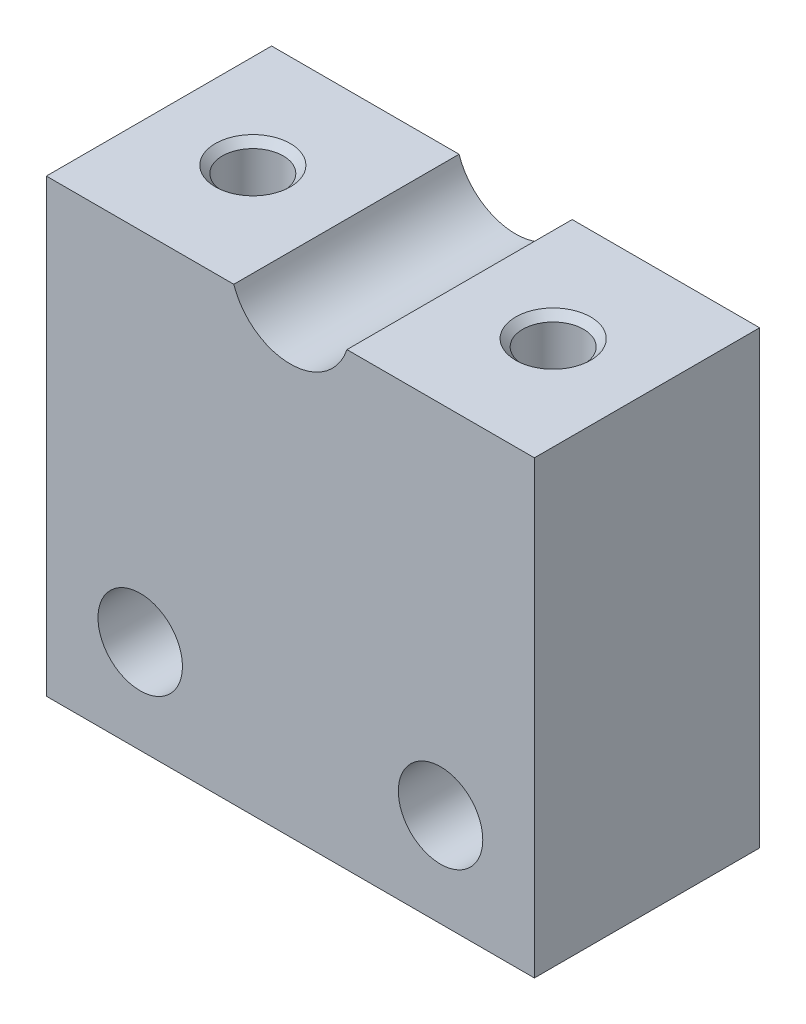
from build123d import *

# Parameters (mm, degrees)
SKETCH1_W                  = 26
SKETCH1_H                  = 24
BOSS_EXTRUDE1_DEPTH        = 12
CUT_EXTRUDE1_DEPTH         = 30.816103032
M3_CLEARANCE_HOLE1_D       = 3.242
M3_CLEARANCE_HOLE1_DEPTH   = 6.064115214
M3_CLEARANCE_HOLE1_TIP     = 0.935884786
F_4_5_4_5_DIAMETER_HOLE1_D = 4.5
CHAMFER1_SIZE              = 0.379


with BuildPart() as part:
    # Sketch1 → Boss-Extrude1 (new body)
    with BuildSketch(Plane.XY.offset(6)):
        with Locations((0, 12)):
            Rectangle(SKETCH1_W, SKETCH1_H)
    extrude(amount=-BOSS_EXTRUDE1_DEPTH)

    # Sketch2 → Cut-Extrude1 (cut, through all)
    with BuildSketch(Plane(origin=(0, 0, -6), x_dir=(-1, 0, 0), z_dir=(0, 0, -1))):
        with BuildLine():
            Line((3.01340754, 24), (-3.01340754, 24))
            ThreePointArc((-3.01340754, 24), (0, 21.825), (3.01340754, 24))
        make_face()
    extrude(amount=-CUT_EXTRUDE1_DEPTH, mode=Mode.SUBTRACT)

    # M3 Clearance Hole1
    with Locations(Plane(origin=(0, 24, 0), x_dir=(1, 0, 0), z_dir=(0, 1, 0))):
        with Locations((8, 0), (-8, 0)):
            Hole(M3_CLEARANCE_HOLE1_D / 2, depth=M3_CLEARANCE_HOLE1_DEPTH)
            with Locations((0, 0, -(M3_CLEARANCE_HOLE1_DEPTH + M3_CLEARANCE_HOLE1_TIP / 2))):  # 120° drill point
                Cone(0, M3_CLEARANCE_HOLE1_D / 2, M3_CLEARANCE_HOLE1_TIP, mode=Mode.SUBTRACT)

    # Ø4.5 (4.5) Diameter Hole1 (through all)
    with Locations(Plane.XY.offset(6)):
        with Locations((8, 5), (-8, 5)):
            Hole(F_4_5_4_5_DIAMETER_HOLE1_D / 2)

    # Chamfer1
    chamfer1_edges = [part.edges().sort_by_distance(p)[0] for p in [
        (-6.379, 24, 0),
        (9.621, 24, 0),
    ]]
    chamfer(chamfer1_edges, length=CHAMFER1_SIZE)


solid = part.part
